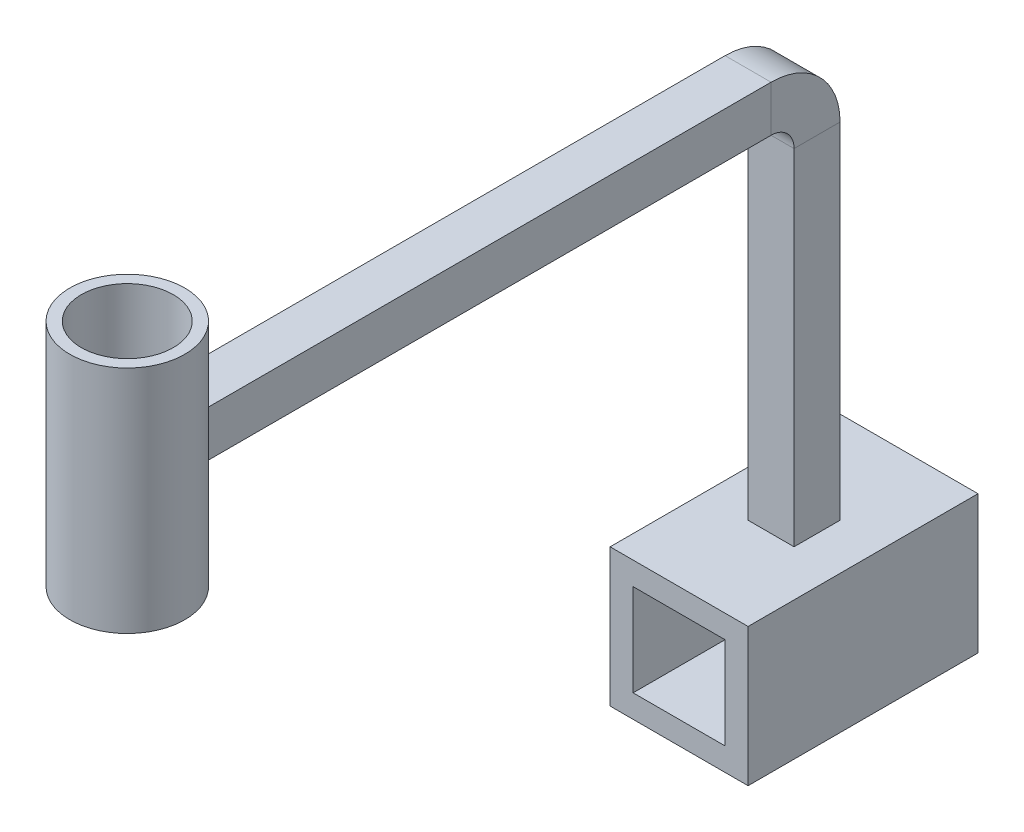
from build123d import *

# Parameters (mm, degrees)
ESQUISSE1_W             = 6
ESQUISSE1_H             = 6
ESQUISSE1_W_2           = 4
ESQUISSE1_H_2           = 4
BOSS_EXTRU_1_DEPTH      = 10
ESQUISSE2_W             = 2
ESQUISSE2_H             = 2
BOSS_EXTRU_2_DEPTH      = 4
BOSS_EXTRU_2_DEPTH_BACK = 6
ESQUISSE4_R             = 2.5
ESQUISSE4_R_2           = 2


with BuildPart() as part:
    # Esquisse1 → Boss.-Extru.1 (new body)
    with BuildSketch(Plane.XY):
        Rectangle(ESQUISSE1_W, ESQUISSE1_H)
        Rectangle(ESQUISSE1_W_2, ESQUISSE1_H_2, mode=Mode.SUBTRACT)
    extrude(amount=BOSS_EXTRU_1_DEPTH)

    # Balayage1: sweep along a path in Esquisse3
    with BuildLine(Plane(origin=(0, 0, 0), x_dir=(0, 0, -1), z_dir=(1, 0, 0))) as balayage1_path:
        Line((-5, 3), (-5, 18))
        ThreePointArc((-5, 18), (-5.585786438, 19.414213562), (-7, 20))
        Line((-7, 20), (-32, 20))
    # Esquisse2 → Balayage1 (sweep)
    with BuildSketch(Plane(origin=(0, 3, 0), x_dir=(1, 0, 0), z_dir=(0, 1, 0))):
        with Locations((0, -5)):
            Rectangle(ESQUISSE2_W, ESQUISSE2_H)
    sweep(path=balayage1_path.line)

    # Esquisse4 → Boss.-Extru.2 (add, two sides: drawn at the far end of the back side and taken through both)
    with BuildSketch(Plane.XZ.offset(-19).offset(-BOSS_EXTRU_2_DEPTH_BACK)):
        with Locations(Location((0, 34, 0), (0, 0, 270))):
            Circle(ESQUISSE4_R)
        with Locations(Location((0, 34, 0), (0, 0, 270))):
            Circle(ESQUISSE4_R_2, mode=Mode.SUBTRACT)
    extrude(amount=BOSS_EXTRU_2_DEPTH + BOSS_EXTRU_2_DEPTH_BACK)


solid = part.part
